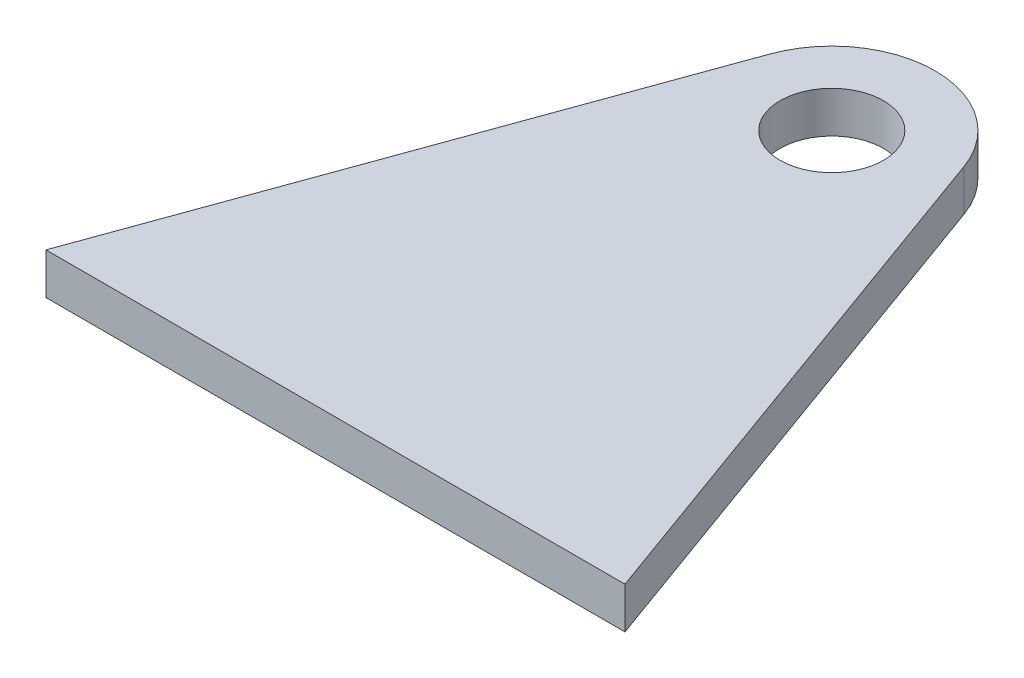
from build123d import *

# Parameters (mm, degrees)
SKETCH1_R           = 25
BOSS_EXTRUDE1_DEPTH = 20


with BuildPart() as part:
    # Sketch1 → Boss-Extrude1 (new body)
    with BuildSketch(Plane(origin=(0, 0, 0), x_dir=(1, 0, 0), z_dir=(0, 1, 0))):
        with BuildLine():
            Line((0, 0), (280, 0))
            Line((280, 0), (187.017565913, 257.010246783))
            ThreePointArc((187.017565913, 257.010246783), (140, 290), (92.982434087, 257.010246783))
            Line((92.982434087, 257.010246783), (0, 0))
        make_face()
        with Locations(Location((140, 240, 0), (0, 0, 270))):
            Circle(SKETCH1_R, mode=Mode.SUBTRACT)
    extrude(amount=BOSS_EXTRUDE1_DEPTH)


solid = part.part
